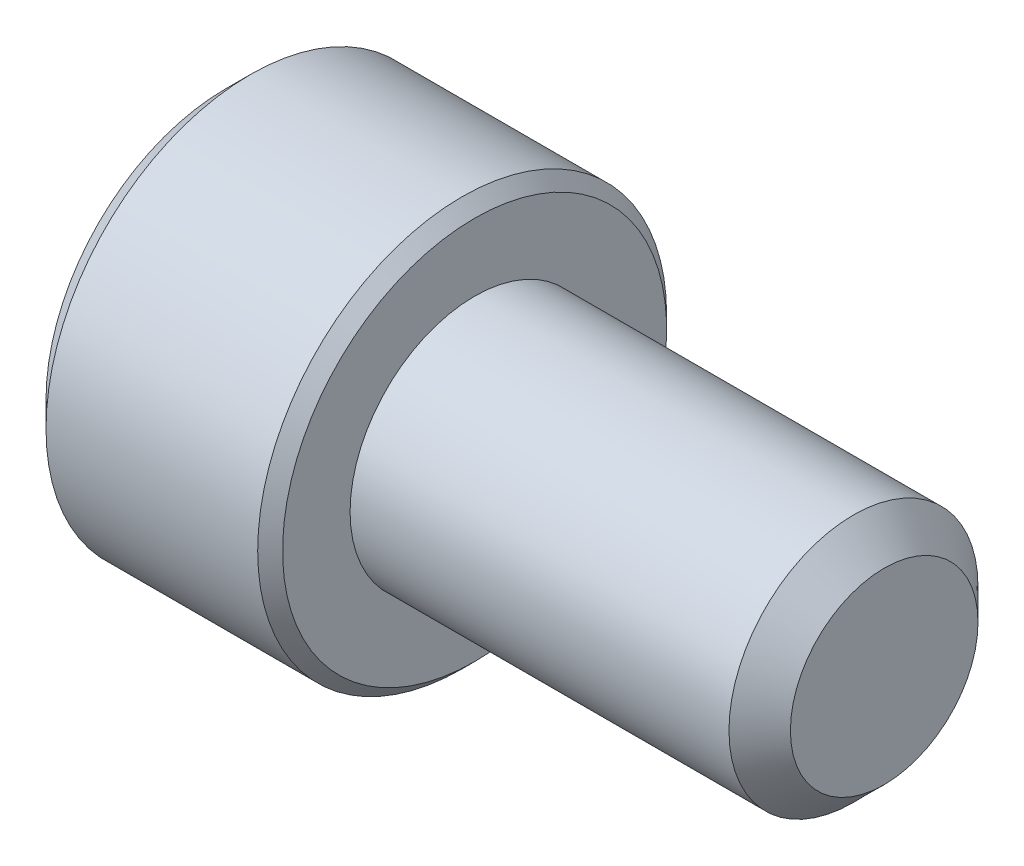
from build123d import *

# Parameters (mm, degrees)
SKETCH2_R           = 2.413
BOSS_EXTRUDE1_DEPTH = 7.9375
CHAMFER1_SIZE       = 0.5953125
CUT_EXTRUDE1_DEPTH  = 2.976562
SKETCH8_R           = 2.291358881
CUT_EXTRUDE2_DEPTH  = 0.9652
CUT_EXTRUDE2_DRAFT  = -45


with BuildPart() as part:
    # Sketch2 → Boss-Extrude1 (new body)
    with BuildSketch(Plane(origin=(3.96875, 0, 0), x_dir=(0, 0, -1), z_dir=(1, 0, 0))):
        Circle(SKETCH2_R)
    extrude(amount=-BOSS_EXTRUDE1_DEPTH)

    # Chamfer1
    chamfer1_edges = [part.edges().sort_by_distance(p)[0] for p in [
        (3.96875, 0, 2.413),
    ]]
    chamfer(chamfer1_edges, length=CHAMFER1_SIZE)

    # Sketch6 → Revolve1 (revolve)
    with BuildSketch(Plane.XY):
        Polygon((-8.31215, 3.9624), (-8.79475, 3.4798), (-8.79475, 0), (-3.96875, 0), (-3.96875, 3.7211), (-4.21005, 3.9624), align=None)
    revolve(axis=Axis((-3.96875, 0, 0), (-1, 0, 0)))

    # Sketch4 → Cut-Extrude1 (cut)
    with BuildSketch(Plane(origin=(-8.79475, 0, 0), x_dir=(0, 0, -1), z_dir=(1, 0, 0))):
        Polygon((0, 2.291358881), (-1.984375, 1.14567944), (-1.984375, -1.14567944), (0, -2.291358881), (1.984375, -1.14567944), (1.984375, 1.14567944), align=None)
    extrude(amount=CUT_EXTRUDE1_DEPTH, mode=Mode.SUBTRACT)


with BuildPart() as cut_extrude2_tool:
    # Sketch8 → Cut-Extrude2 (with draft: the straight prism first)
    with BuildSketch(Plane.ZY.offset(8.79475)):
        Circle(SKETCH8_R)
    extrude(amount=-CUT_EXTRUDE2_DEPTH)
    # Cut-Extrude2: the draft: its side faces are tilted about the plane it starts from
    cut_extrude2_sides = [cut_extrude2_tool.faces().sort_by_distance(p)[0] for p in [
        (-8.31215, 0, -2.291358881),
    ]]
    draft(cut_extrude2_sides, Plane.ZY.offset(8.79475), CUT_EXTRUDE2_DRAFT)


with BuildPart() as part_1:
    add(part.part)

    # Cut-Extrude2: cut by cut_extrude2_tool
    add(cut_extrude2_tool.part, mode=Mode.SUBTRACT)


solid = part_1.part
